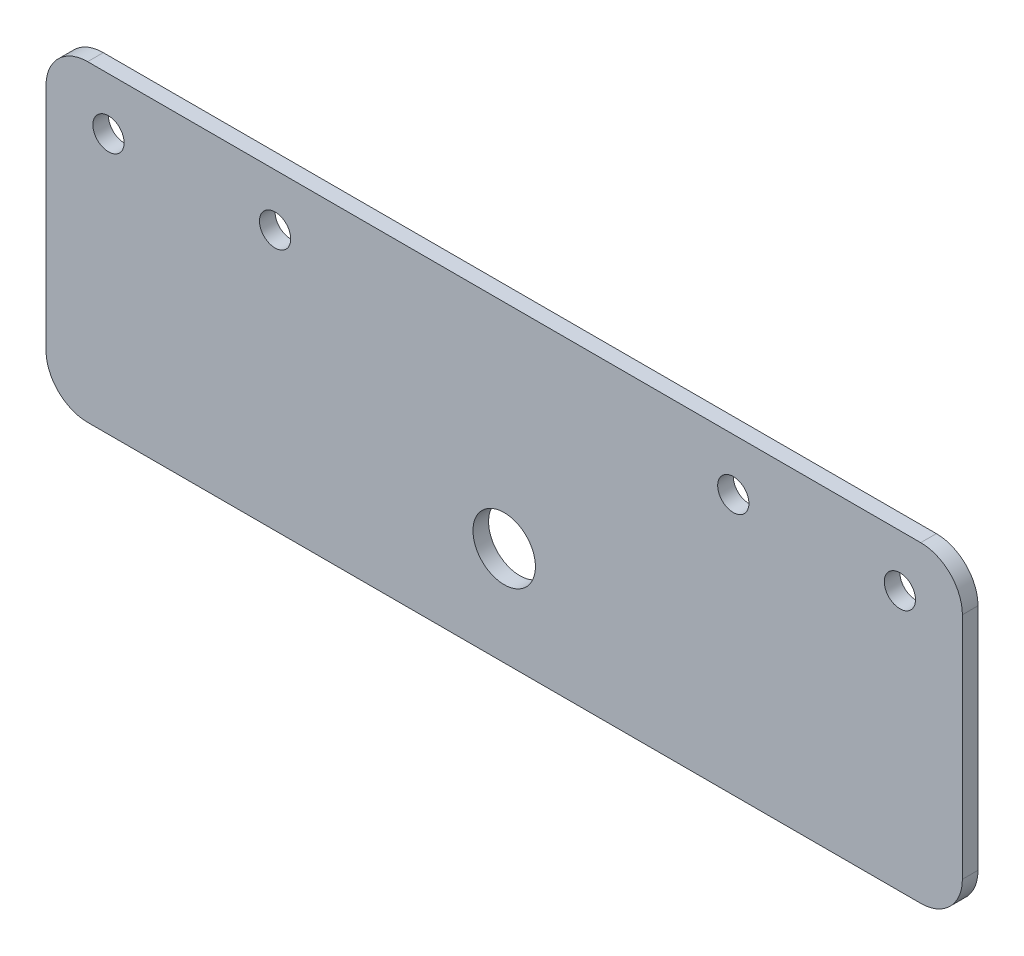
from build123d import *

# Parameters (mm, degrees)
SKETCH_1_R      = 3
SKETCH_1_R_2    = 1.5
EXTRUDE_1_DEPTH = 1.5


with BuildPart() as part:
    # 草图1 → 凸台-拉伸1 (new body)
    with BuildSketch(Plane.XY):
        with BuildLine():
            Line((-25.801260856, 11.030846734), (34.198739144, 11.030846734))
            Line((34.198739144, 11.030846734), (44.198739144, 11.030846734))
            ThreePointArc((44.198739144, 11.030846734), (47.027166269, 9.859273858), (48.198739144, 7.030846734))
            Line((48.198739144, 7.030846734), (48.198739144, -14.969153266))
            ThreePointArc((48.198739144, -14.969153266), (47.027166269, -17.797580391), (44.198739144, -18.969153266))
            Line((44.198739144, -18.969153266), (34.198739144, -18.969153266))
            Line((34.198739144, -18.969153266), (-25.801260856, -18.969153266))
            Line((-25.801260856, -18.969153266), (-35.801260856, -18.969153266))
            ThreePointArc((-35.801260856, -18.969153266), (-38.62968798, -17.797580391), (-39.801260856, -14.969153266))
            Line((-39.801260856, -14.969153266), (-39.801260856, 7.030846734))
            ThreePointArc((-39.801260856, 7.030846734), (-38.62968798, 9.859273858), (-35.801260856, 11.030846734))
            Line((-35.801260856, 11.030846734), (-25.801260856, 11.030846734))
        make_face()
        with Locations((4.198739144, -9.469153266)):
            Circle(SKETCH_1_R, mode=Mode.SUBTRACT)
        with Locations((-17.801260856, 6.030846734)):
            Circle(SKETCH_1_R_2, mode=Mode.SUBTRACT)
        with Locations((-33.801260856, 6.030846734)):
            Circle(SKETCH_1_R_2, mode=Mode.SUBTRACT)
        with Locations((26.198739144, 6.030846734)):
            Circle(SKETCH_1_R_2, mode=Mode.SUBTRACT)
        with Locations((42.198739144, 6.030846734)):
            Circle(SKETCH_1_R_2, mode=Mode.SUBTRACT)
    extrude(amount=EXTRUDE_1_DEPTH)


solid = part.part
